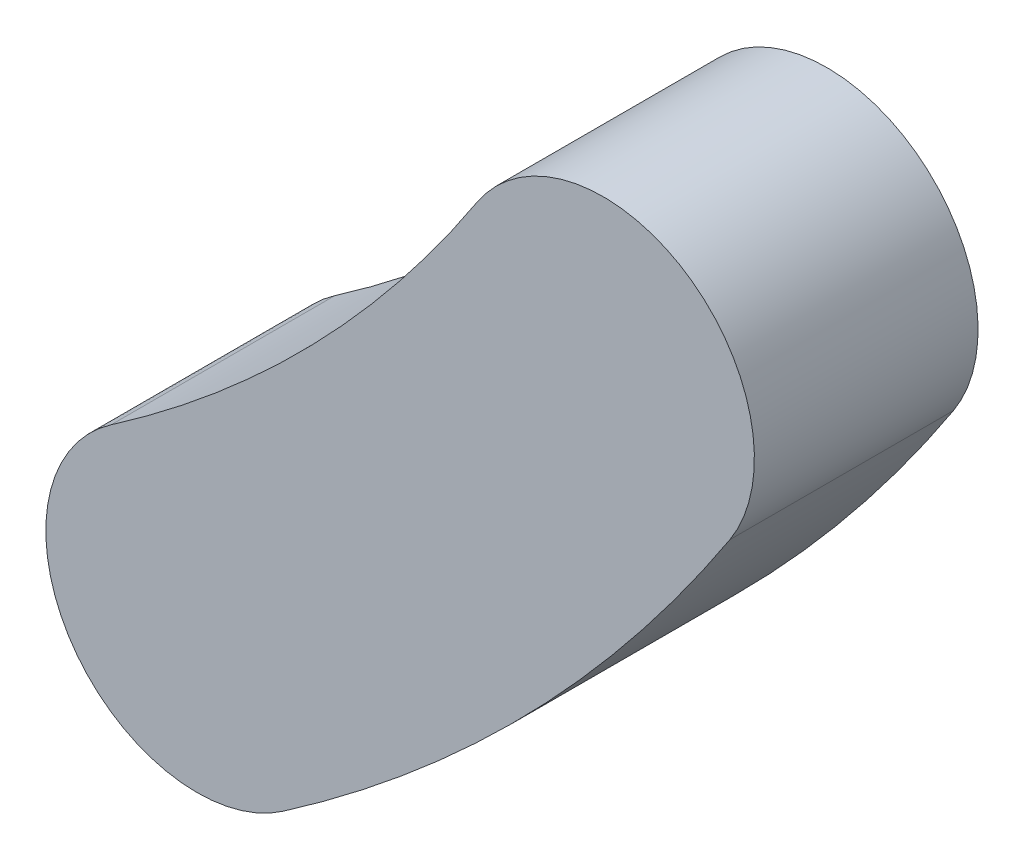
from build123d import *

# Parameters (mm, degrees)
BOSS_EXTRUDE1_DEPTH = 3


with BuildPart() as part:
    # Sketch1 → Boss-Extrude1 (new body)
    with BuildSketch(Plane(origin=(70, 0, 0), x_dir=(1, 0, 0), z_dir=(0, 0, 1))):
        with BuildLine():
            ThreePointArc((27.710255168, 2.761444832), (31.008202169, 5.545099335), (33.705299459, 8.914202038))
            ThreePointArc((33.705299459, 8.914202038), (33.113994499, 11.720405137), (30.3077914, 11.129100178))
            ThreePointArc((30.3077914, 11.129100178), (28.103389968, 8.37545282), (25.407899848, 6.100306129))
            ThreePointArc((25.407899848, 6.100306129), (24.889646859, 3.279697821), (27.710255168, 2.761444832))
        make_face()
    extrude(amount=BOSS_EXTRUDE1_DEPTH)


solid = part.part
